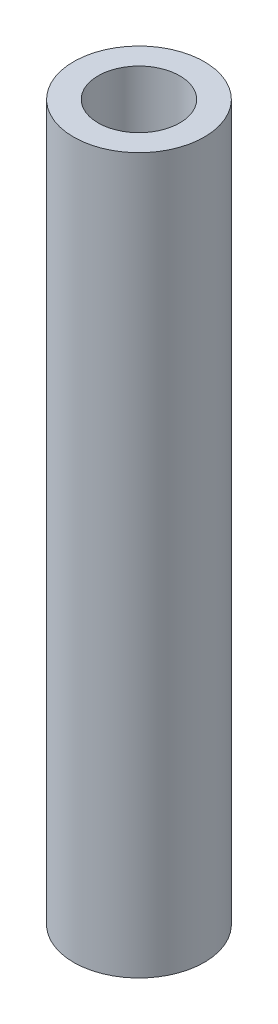
from build123d import *

# Parameters (mm, degrees)
SKETCH_1_R      = 4
SKETCH_1_R_2    = 2.5
EXTRUDE_1_DEPTH = 43.75


with BuildPart() as part:
    # 草图1 → 凸台-拉伸1 (new body)
    with BuildSketch(Plane(origin=(0, 0, 0), x_dir=(1, 0, 0), z_dir=(0, 1, 0))):
        with Locations(Location((0, 0, 0), (0, 0, 270))):
            Circle(SKETCH_1_R)
        with Locations(Location((0, 0, 0), (0, 0, 270))):
            Circle(SKETCH_1_R_2, mode=Mode.SUBTRACT)
    extrude(amount=EXTRUDE_1_DEPTH)


solid = part.part
